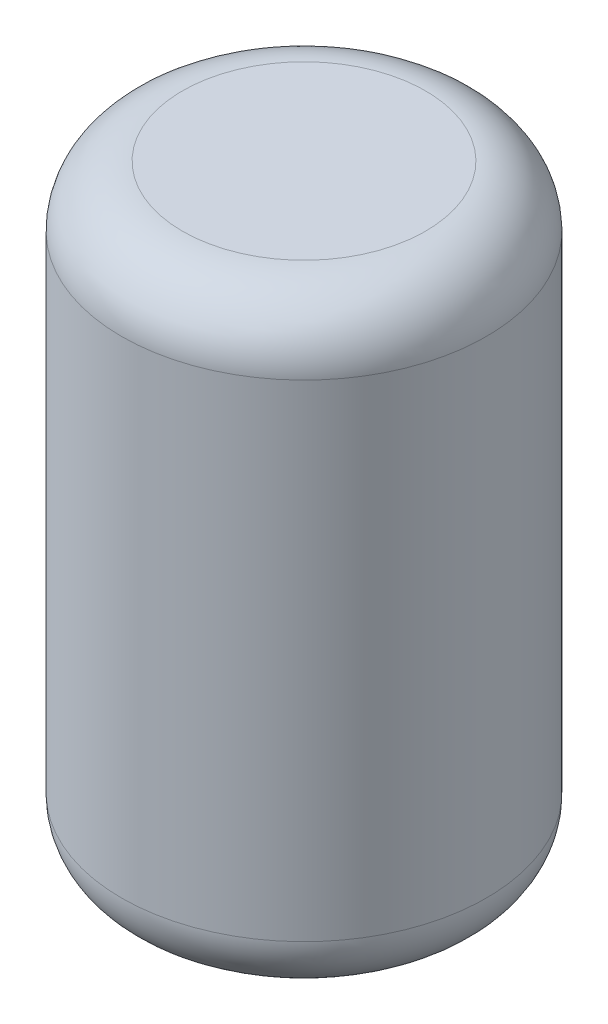
from build123d import *

# Parameters (mm, degrees)
SKETCH_2_R      = 30
EXTRUDE_1_DEPTH = 100
FILLET_1_R      = 10


with BuildPart() as part:
    # 草圖2 → 伸長1 (new body)
    with BuildSketch(Plane(origin=(0, 0, 0), x_dir=(1, 0, 0), z_dir=(0, 1, 0))):
        with Locations(Location((0, 0, 0), (0, 0, 270))):
            Circle(SKETCH_2_R)
    extrude(amount=EXTRUDE_1_DEPTH)

    # 圓角1
    fillet_1_edges = [part.edges().sort_by_distance(p)[0] for p in [
        (0, 0, -30),
        (0, 100, -30),
    ]]
    fillet(fillet_1_edges, radius=FILLET_1_R)


solid = part.part
